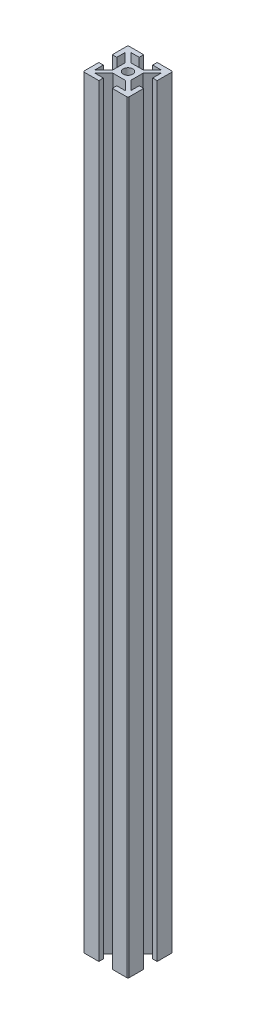
from build123d import *

# Parameters (mm, degrees)
SKETCH1_R           = 2.1
BOSS_EXTRUDE1_DEPTH = 340


with BuildPart() as part:
    # Sketch1 → Boss-Extrude1 (new body)
    with BuildSketch(Plane(origin=(0, 340, 0), x_dir=(1, 0, 0), z_dir=(0, 1, 0))):
        with BuildLine():
            Line((4, 2.746364236), (8, 6.746364236))
            Line((8, 6.746364236), (8, 3))
            Line((8, 3), (10, 3))
            Line((10, 3), (10, 9.5))
            ThreePointArc((10, 9.5), (9.853553391, 9.853553391), (9.5, 10))
            Line((9.5, 10), (3, 10))
            Line((3, 10), (3, 8))
            Line((3, 8), (6.863334179, 8))
            Line((6.863334179, 8), (2.863334179, 4))
            Line((2.863334179, 4), (-2.75, 4))
            Line((-2.75, 4), (-6.75, 8))
            Line((-6.75, 8), (-3, 8))
            Line((-3, 8), (-3, 10))
            Line((-3, 10), (-9.5, 10))
            ThreePointArc((-9.5, 10), (-9.853553391, 9.853553391), (-10, 9.5))
            Line((-10, 9.5), (-10, 3))
            Line((-10, 3), (-8, 3))
            Line((-8, 3), (-8, 6.75))
            Line((-8, 6.75), (-4, 2.75))
            Line((-4, 2.75), (-4, -2.75))
            Line((-4, -2.75), (-8, -6.75))
            Line((-8, -6.75), (-8, -3))
            Line((-8, -3), (-10, -3))
            Line((-10, -3), (-10, -9.5))
            ThreePointArc((-10, -9.5), (-9.853553391, -9.853553391), (-9.5, -10))
            Line((-9.5, -10), (-3, -10))
            Line((-3, -10), (-3, -8))
            Line((-3, -8), (-6.75, -8))
            Line((-6.75, -8), (-2.75, -4))
            Line((-2.75, -4), (2.868469119, -4))
            Line((2.868469119, -4), (6.868469119, -8))
            Line((6.868469119, -8), (3, -8))
            Line((3, -8), (3, -10))
            Line((3, -10), (9.5, -10))
            ThreePointArc((9.5, -10), (9.853553391, -9.853553391), (10, -9.5))
            Line((10, -9.5), (10, -3))
            Line((10, -3), (8, -3))
            Line((8, -3), (8, -6.665189266))
            Line((8, -6.665189266), (4, -2.665189266))
            Line((4, -2.665189266), (4, 2.746364236))
        make_face()
        with Locations(Location((0, 0, 0), (0, 0, 90))):
            Circle(SKETCH1_R, mode=Mode.SUBTRACT)
    extrude(amount=-BOSS_EXTRUDE1_DEPTH)


solid = part.part
